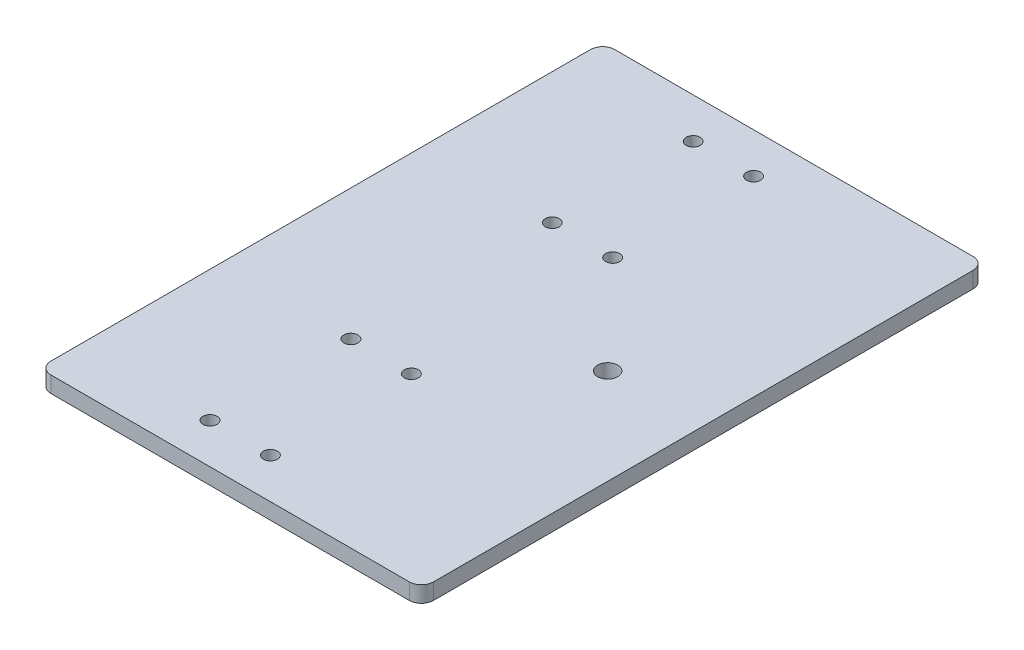
from build123d import *

# Parameters (mm, degrees)
SKETCH1_W           = 95
SKETCH1_H           = 140
SKETCH1_R           = 1.75
SKETCH1_R_2         = 2.5
BOSS_EXTRUDE1_DEPTH = 4
FILLET1_R           = 3


with BuildPart() as part:
    # Sketch1 → Boss-Extrude1 (new body)
    with BuildSketch(Plane(origin=(0, 0, 0), x_dir=(1, 0, 0), z_dir=(0, 1, 0))):
        Rectangle(SKETCH1_W, SKETCH1_H)
        with Locations(Location((0, 60, 0), (0, 0, 270))):
            Circle(SKETCH1_R, mode=Mode.SUBTRACT)
        with Locations(Location((0, 25, 0), (0, 0, 270))):
            Circle(SKETCH1_R, mode=Mode.SUBTRACT)
        with Locations(Location((0, -25, 0), (0, 0, 90))):
            Circle(SKETCH1_R, mode=Mode.SUBTRACT)
        with Locations(Location((0, -60, 0), (0, 0, 90))):
            Circle(SKETCH1_R, mode=Mode.SUBTRACT)
        with Locations(Location((-15, 60, 0), (0, 0, 270))):
            Circle(SKETCH1_R, mode=Mode.SUBTRACT)
        with Locations(Location((-15, 25, 0), (0, 0, 270))):
            Circle(SKETCH1_R, mode=Mode.SUBTRACT)
        with Locations(Location((-15, -25, 0), (0, 0, 90))):
            Circle(SKETCH1_R, mode=Mode.SUBTRACT)
        with Locations(Location((-15, -60, 0), (0, 0, 90))):
            Circle(SKETCH1_R, mode=Mode.SUBTRACT)
        with Locations(Location((23.75, 0, 0), (0, 0, 270))):
            Circle(SKETCH1_R_2, mode=Mode.SUBTRACT)
    extrude(amount=BOSS_EXTRUDE1_DEPTH)

    # Fillet1
    fillet1_edges = [part.edges().sort_by_distance(p)[0] for p in [
        (47.5, 2, 70),
        (-47.5, 2, 70),
        (-47.5, 2, -70),
        (47.5, 2, -70),
    ]]
    fillet(fillet1_edges, radius=FILLET1_R)


solid = part.part
